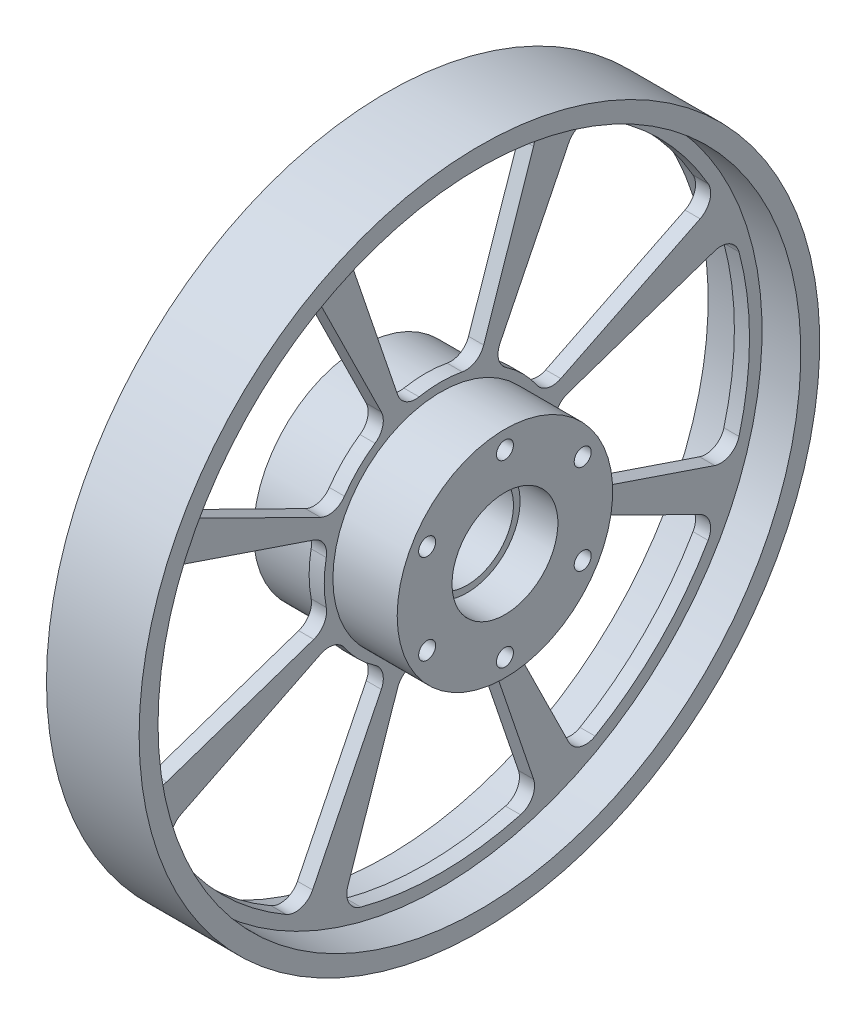
from build123d import *

# Parameters (mm, degrees)
SKETCH2_R          = 2.25
CUT_EXTRUDE1_DEPTH = 40
CUT_EXTRUDE2_DEPTH = 40


with BuildPart() as part:
    # Sketch1 → Revolve1 (revolve)
    with BuildSketch(Plane(origin=(0, 0, 0), x_dir=(1, 0, 0), z_dir=(0, 1, 0)), mode=Mode.PRIVATE) as revolve1_sk:
        Polygon((-9, 12.25), (9, 12.25), (9, 14), (19, 14), (19, 28.5), (2, 28.5), (2, 85), (12.25, 85), (12.25, 90), (-12.25, 90), (-12.25, 85), (-2, 85), (-2, 28.5), (-19, 28.5), (-19, 14), (-9, 14), align=None)
    revolve(revolve1_sk.sketch.rotate(Axis((0, 0, 0), (1, 0, 0)), 180), axis=Axis((0, 0, 0), (1, 0, 0)))

    # Sketch2 → Cut-Extrude1 (cut)
    with BuildSketch(Plane(origin=(19, 0, 0), x_dir=(0, 0, -1), z_dir=(1, 0, 0))):
        with Locations((0, 23.75)):
            Circle(SKETCH2_R)
        with Locations((20.56810334, 11.875)):
            Circle(SKETCH2_R)
        with Locations((20.56810334, -11.875)):
            Circle(SKETCH2_R)
        with Locations((0, -23.75)):
            Circle(SKETCH2_R)
        with Locations((-20.56810334, -11.875)):
            Circle(SKETCH2_R)
        with Locations((-20.56810334, 11.875)):
            Circle(SKETCH2_R)
    extrude(amount=-CUT_EXTRUDE1_DEPTH, mode=Mode.SUBTRACT)

    # Sketch3 → Cut-Extrude2 (cut)
    with BuildSketch(Plane.ZY.offset(2)):
        with BuildLine():
            Line((33.864614623, 68.618602963), (15.68286139, 31.777595908))
            ThreePointArc((15.68286139, 31.777595908), (15.330601224, 28.294565139), (17.34904213, 25.434235286))
            ThreePointArc((17.34904213, 25.434235286), (21.770273165, 21.770273165), (25.434235286, 17.34904213))
            ThreePointArc((25.434235286, 17.34904213), (28.294565139, 15.330601224), (31.777595908, 15.68286139))
            Line((31.777595908, 15.68286139), (68.618602963, 33.864614623))
            ThreePointArc((68.618602963, 33.864614623), (71.190803513, 36.897849656), (70.735686396, 40.848748142))
            ThreePointArc((70.735686396, 40.848748142), (57.758798268, 57.758798268), (40.848748142, 70.735686396))
            ThreePointArc((40.848748142, 70.735686396), (36.897849656, 71.190803513), (33.864614623, 68.618602963))
        make_face()
        with BuildLine():
            Line((72.466578112, 24.574780828), (33.559611194, 11.380695919))
            ThreePointArc((33.559611194, 11.380695919), (30.847650966, 9.166906795), (30.252345582, 5.717094908))
            ThreePointArc((30.252345582, 5.717094908), (30.787815567, 0), (30.252345582, -5.717094908))
            ThreePointArc((30.252345582, -5.717094908), (30.847650966, -9.166906795), (33.559611194, -11.380695919))
            Line((33.559611194, -11.380695919), (72.466578112, -24.574780828))
            ThreePointArc((72.466578112, -24.574780828), (76.430219625, -24.248780219), (78.902110336, -21.133256708))
            ThreePointArc((78.902110336, -21.133256708), (81.683275856, 0), (78.902110336, 21.133256708))
            ThreePointArc((78.902110336, 21.133256708), (76.430219625, 24.248780219), (72.466578112, 24.574780828))
        make_face()
        with BuildLine():
            Line((-24.574780828, 72.466578112), (-11.380695919, 33.559611194))
            ThreePointArc((-11.380695919, 33.559611194), (-9.166906795, 30.847650966), (-5.717094908, 30.252345582))
            ThreePointArc((-5.717094908, 30.252345582), (0, 30.787815567), (5.717094908, 30.252345582))
            ThreePointArc((5.717094908, 30.252345582), (9.166906795, 30.847650966), (11.380695919, 33.559611194))
            Line((11.380695919, 33.559611194), (24.574780828, 72.466578112))
            ThreePointArc((24.574780828, 72.466578112), (24.248780219, 76.430219625), (21.133256708, 78.902110336))
            ThreePointArc((21.133256708, 78.902110336), (0, 81.683275856), (-21.133256708, 78.902110336))
            ThreePointArc((-21.133256708, 78.902110336), (-24.248780219, 76.430219625), (-24.574780828, 72.466578112))
        make_face()
        with BuildLine():
            Line((68.618602963, -33.864614623), (31.777595908, -15.68286139))
            ThreePointArc((31.777595908, -15.68286139), (28.294565139, -15.330601224), (25.434235286, -17.34904213))
            ThreePointArc((25.434235286, -17.34904213), (21.770273165, -21.770273165), (17.34904213, -25.434235286))
            ThreePointArc((17.34904213, -25.434235286), (15.330601224, -28.294565139), (15.68286139, -31.777595908))
            Line((15.68286139, -31.777595908), (33.864614623, -68.618602963))
            ThreePointArc((33.864614623, -68.618602963), (36.897849656, -71.190803513), (40.848748142, -70.735686396))
            ThreePointArc((40.848748142, -70.735686396), (57.758798268, -57.758798268), (70.735686396, -40.848748142))
            ThreePointArc((70.735686396, -40.848748142), (71.190803513, -36.897849656), (68.618602963, -33.864614623))
        make_face()
        with BuildLine():
            Line((24.574780828, -72.466578112), (11.380695919, -33.559611194))
            ThreePointArc((11.380695919, -33.559611194), (9.166906795, -30.847650966), (5.717094908, -30.252345582))
            ThreePointArc((5.717094908, -30.252345582), (0, -30.787815567), (-5.717094908, -30.252345582))
            ThreePointArc((-5.717094908, -30.252345582), (-9.166906795, -30.847650966), (-11.380695919, -33.559611194))
            Line((-11.380695919, -33.559611194), (-24.574780828, -72.466578112))
            ThreePointArc((-24.574780828, -72.466578112), (-24.248780219, -76.430219625), (-21.133256708, -78.902110336))
            ThreePointArc((-21.133256708, -78.902110336), (0, -81.683275856), (21.133256708, -78.902110336))
            ThreePointArc((21.133256708, -78.902110336), (24.248780219, -76.430219625), (24.574780828, -72.466578112))
        make_face()
        with BuildLine():
            Line((-33.864614623, -68.618602963), (-15.68286139, -31.777595908))
            ThreePointArc((-15.68286139, -31.777595908), (-15.330601224, -28.294565139), (-17.34904213, -25.434235286))
            ThreePointArc((-17.34904213, -25.434235286), (-21.770273165, -21.770273165), (-25.434235286, -17.34904213))
            ThreePointArc((-25.434235286, -17.34904213), (-28.294565139, -15.330601224), (-31.777595908, -15.68286139))
            Line((-31.777595908, -15.68286139), (-68.618602963, -33.864614623))
            ThreePointArc((-68.618602963, -33.864614623), (-71.190803513, -36.897849656), (-70.735686396, -40.848748142))
            ThreePointArc((-70.735686396, -40.848748142), (-57.758798268, -57.758798268), (-40.848748142, -70.735686396))
            ThreePointArc((-40.848748142, -70.735686396), (-36.897849656, -71.190803513), (-33.864614623, -68.618602963))
        make_face()
        with BuildLine():
            Line((-72.466578112, -24.574780828), (-33.559611194, -11.380695919))
            ThreePointArc((-33.559611194, -11.380695919), (-30.847650966, -9.166906795), (-30.252345582, -5.717094908))
            ThreePointArc((-30.252345582, -5.717094908), (-30.787815567, 0), (-30.252345582, 5.717094908))
            ThreePointArc((-30.252345582, 5.717094908), (-30.847650966, 9.166906795), (-33.559611194, 11.380695919))
            Line((-33.559611194, 11.380695919), (-72.466578112, 24.574780828))
            ThreePointArc((-72.466578112, 24.574780828), (-76.430219625, 24.248780219), (-78.902110336, 21.133256708))
            ThreePointArc((-78.902110336, 21.133256708), (-81.683275856, 0), (-78.902110336, -21.133256708))
            ThreePointArc((-78.902110336, -21.133256708), (-76.430219625, -24.248780219), (-72.466578112, -24.574780828))
        make_face()
        with BuildLine():
            Line((-68.618602963, 33.864614623), (-31.777595908, 15.68286139))
            ThreePointArc((-31.777595908, 15.68286139), (-28.294565139, 15.330601224), (-25.434235286, 17.34904213))
            ThreePointArc((-25.434235286, 17.34904213), (-21.770273165, 21.770273165), (-17.34904213, 25.434235286))
            ThreePointArc((-17.34904213, 25.434235286), (-15.330601224, 28.294565139), (-15.68286139, 31.777595908))
            Line((-15.68286139, 31.777595908), (-33.864614623, 68.618602963))
            ThreePointArc((-33.864614623, 68.618602963), (-36.897849656, 71.190803513), (-40.848748142, 70.735686396))
            ThreePointArc((-40.848748142, 70.735686396), (-57.758798268, 57.758798268), (-70.735686396, 40.848748142))
            ThreePointArc((-70.735686396, 40.848748142), (-71.190803513, 36.897849656), (-68.618602963, 33.864614623))
        make_face()
    extrude(amount=-CUT_EXTRUDE2_DEPTH, mode=Mode.SUBTRACT)


solid = part.part
